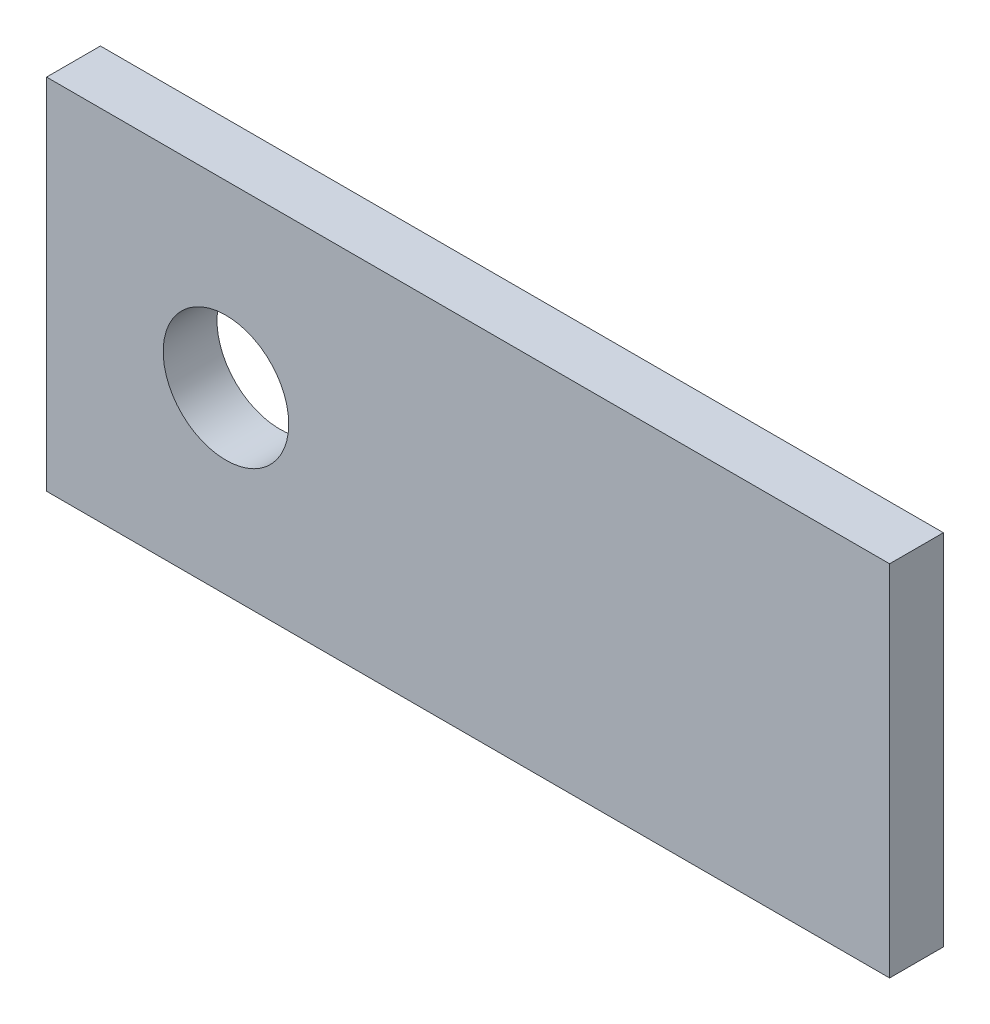
from build123d import *

# Parameters (mm, degrees)
ESQUISSE1_W        = 4.7
ESQUISSE1_H        = 2
ESQUISSE1_R        = 0.35
BOSS_EXTRU_1_DEPTH = 0.3


with BuildPart() as part:
    # Esquisse1 → Boss.-Extru.1 (new body)
    with BuildSketch(Plane.XY):
        with Locations((2.35, -1)):
            Rectangle(ESQUISSE1_W, ESQUISSE1_H)
        with Locations((1, -1)):
            Circle(ESQUISSE1_R, mode=Mode.SUBTRACT)
    extrude(amount=BOSS_EXTRU_1_DEPTH)


solid = part.part
